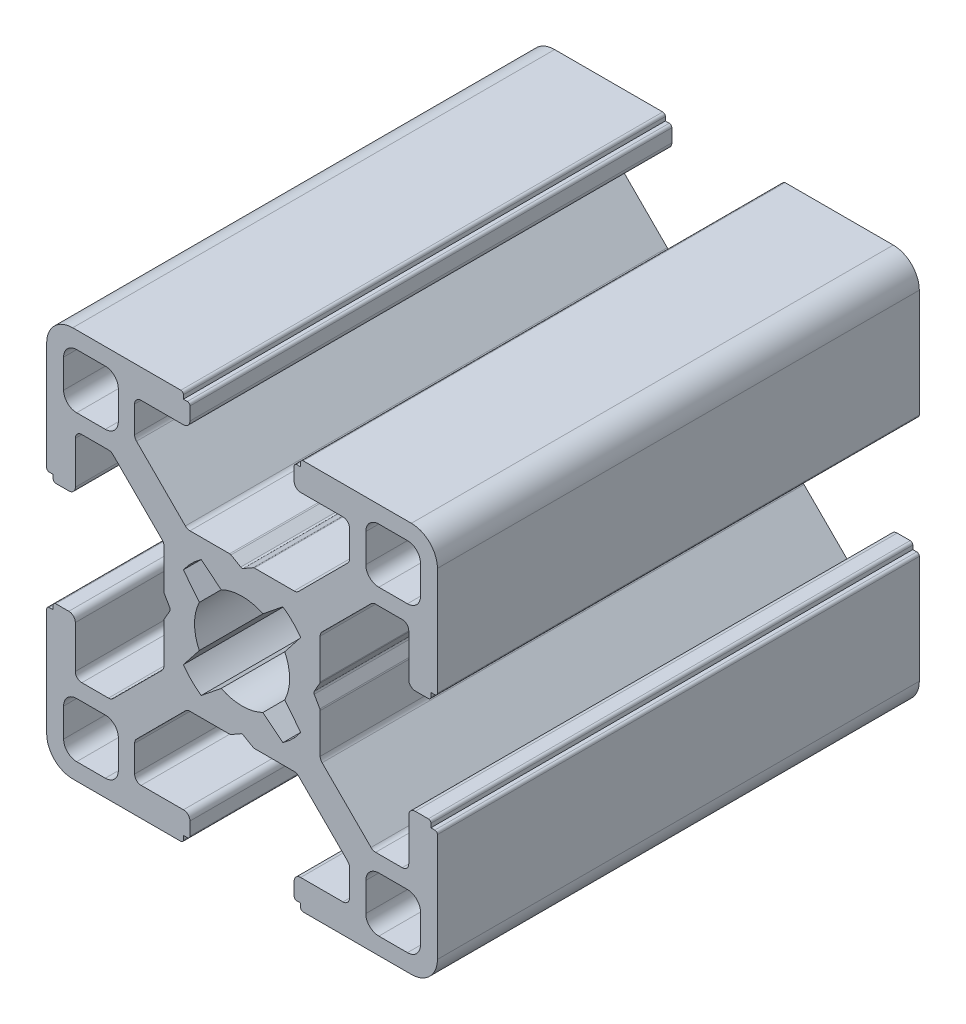
from build123d import *

# Parameters (mm, degrees)
SALIENTE_EXTRUIR1_DEPTH = 1000
CORTAR_EXTRUIR1_START   = -963
CORTAR_EXTRUIR1_DEPTH   = 963


with BuildPart() as part:
    # Croquis1 → Saliente-Extruir1 (new body)
    with BuildSketch(Plane.XY.offset(1000)):
        with BuildLine():
            Line((9.800000436, -10.500000436), (10.100000436, -10.500000436))
            ThreePointArc((10.100000436, -10.500000436), (10.241421792, -10.441421792), (10.300000436, -10.300000436))
            Line((10.300000436, -10.300000436), (10.300000436, -2))
            ThreePointArc((10.300000436, -2), (9.714213998, -0.585786438), (8.300000436, 0))
            Line((8.300000436, 0), (0, 0))
            ThreePointArc((0, 0), (-0.141421356, -0.058578644), (-0.2, -0.2))
            Line((-0.2, -0.2), (-0.2, -0.5))
            Line((-0.2, -0.5), (-0.49999919, -0.5))
            ThreePointArc((-0.49999919, -0.5), (-0.641420811, -0.558578753), (-0.699999564, -0.700000374))
            Line((-0.699999564, -0.700000374), (-0.699999564, -1.700000763))
            ThreePointArc((-0.699999564, -1.700000763), (-0.553552955, -2.053554154), (-0.199999564, -2.200000763))
            Line((-0.199999564, -2.200000763), (3.050000763, -2.200000763))
            ThreePointArc((3.050000763, -2.200000763), (3.403554154, -2.346447372), (3.550000763, -2.700000763))
            Line((3.550000763, -2.700000763), (3.550000763, -4.743055509))
            ThreePointArc((3.550000763, -4.743055509), (3.511993279, -4.934269826), (3.403749103, -5.096413843))
            Line((3.403749103, -5.096413843), (-0.349053376, -8.853358334))
            ThreePointArc((-0.349053376, -8.853358334), (-0.511332616, -8.961886981), (-0.702801716, -9))
            Line((-0.702801716, -9), (-3.746809419, -9))
            ThreePointArc((-3.746809419, -9), (-3.798212795, -9.006718618), (-3.846162576, -9.026423071))
            Line((-3.846162576, -9.026423071), (-4.600646407, -9.458279719))
            ThreePointArc((-4.600646407, -9.458279719), (-4.699999564, -9.48470279), (-4.799352721, -9.458279719))
            Line((-4.799352721, -9.458279719), (-5.553836552, -9.026423071))
            ThreePointArc((-5.553836552, -9.026423071), (-5.601786333, -9.006718618), (-5.653189709, -9))
            Line((-5.653189709, -9), (-8.697197412, -9))
            ThreePointArc((-8.697197412, -9), (-8.888666513, -8.961886981), (-9.050945752, -8.853358334))
            Line((-9.050945752, -8.853358334), (-12.803748231, -5.096413843))
            ThreePointArc((-12.803748231, -5.096413843), (-12.911992407, -4.934269826), (-12.949999891, -4.743055509))
            Line((-12.949999891, -4.743055509), (-12.949999891, -2.700000763))
            ThreePointArc((-12.949999891, -2.700000763), (-12.803553282, -2.346447372), (-12.449999891, -2.200000763))
            Line((-12.449999891, -2.200000763), (-9.199999564, -2.200000763))
            ThreePointArc((-9.199999564, -2.200000763), (-8.846446173, -2.053554154), (-8.699999564, -1.700000763))
            Line((-8.699999564, -1.700000763), (-8.699999564, -0.700000374))
            ThreePointArc((-8.699999564, -0.700000374), (-8.758578317, -0.558578753), (-8.899999938, -0.5))
            Line((-8.899999938, -0.5), (-9.199999128, -0.5))
            Line((-9.199999128, -0.5), (-9.199999128, -0.2))
            ThreePointArc((-9.199999128, -0.2), (-9.258577772, -0.058578644), (-9.399999128, 0))
            Line((-9.399999128, 0), (-17.699999564, 0))
            ThreePointArc((-17.699999564, 0), (-19.114213126, -0.585786438), (-19.699999564, -2))
            Line((-19.699999564, -2), (-19.699999564, -10.300000436))
            ThreePointArc((-19.699999564, -10.300000436), (-19.64142092, -10.441421792), (-19.499999564, -10.500000436))
            Line((-19.499999564, -10.500000436), (-19.199999564, -10.500000436))
            Line((-19.199999564, -10.500000436), (-19.199999564, -10.799999627))
            ThreePointArc((-19.199999564, -10.799999627), (-19.141420811, -10.941421247), (-18.99999919, -11))
            Line((-18.99999919, -11), (-17.999998801, -11))
            ThreePointArc((-17.999998801, -11), (-17.64644541, -10.853553391), (-17.499998801, -10.5))
            Line((-17.499998801, -10.5), (-17.499998801, -7.249999673))
            ThreePointArc((-17.499998801, -7.249999673), (-17.353552192, -6.896446283), (-16.999998801, -6.749999673))
            Line((-16.999998801, -6.749999673), (-14.956944055, -6.749999673))
            ThreePointArc((-14.956944055, -6.749999673), (-14.765729738, -6.788007157), (-14.603585721, -6.896251334))
            Line((-14.603585721, -6.896251334), (-10.84664123, -10.649053813))
            ThreePointArc((-10.84664123, -10.649053813), (-10.738112583, -10.811333052), (-10.699999564, -11.002802152))
            Line((-10.699999564, -11.002802152), (-10.699999564, -14.046809855))
            ThreePointArc((-10.699999564, -14.046809855), (-10.693280947, -14.098213232), (-10.673576493, -14.146163012))
            Line((-10.673576493, -14.146163012), (-10.241719845, -14.900646843))
            ThreePointArc((-10.241719845, -14.900646843), (-10.215296774, -15), (-10.241719845, -15.099353157))
            Line((-10.241719845, -15.099353157), (-10.673576493, -15.853836988))
            ThreePointArc((-10.673576493, -15.853836988), (-10.693280947, -15.901786769), (-10.699999564, -15.953190146))
            Line((-10.699999564, -15.953190146), (-10.699999564, -18.997197848))
            ThreePointArc((-10.699999564, -18.997197848), (-10.738112583, -19.188666949), (-10.84664123, -19.350946188))
            Line((-10.84664123, -19.350946188), (-14.603585721, -23.103748667))
            ThreePointArc((-14.603585721, -23.103748667), (-14.765729738, -23.211992843), (-14.956944055, -23.250000327))
            Line((-14.956944055, -23.250000327), (-16.999998801, -23.250000327))
            ThreePointArc((-16.999998801, -23.250000327), (-17.353552192, -23.103553718), (-17.499998801, -22.750000327))
            Line((-17.499998801, -22.750000327), (-17.499998801, -19.5))
            ThreePointArc((-17.499998801, -19.5), (-17.64644541, -19.14644661), (-17.999998801, -19))
            Line((-17.999998801, -19), (-18.99999919, -19))
            ThreePointArc((-18.99999919, -19), (-19.141420811, -19.058578753), (-19.199999564, -19.200000374))
            Line((-19.199999564, -19.200000374), (-19.199999564, -19.499999564))
            Line((-19.199999564, -19.499999564), (-19.499999564, -19.499999564))
            ThreePointArc((-19.499999564, -19.499999564), (-19.64142092, -19.558578208), (-19.699999564, -19.699999564))
            Line((-19.699999564, -19.699999564), (-19.699999564, -28))
            ThreePointArc((-19.699999564, -28), (-19.114213126, -29.414213563), (-17.699999564, -30))
            Line((-17.699999564, -30), (-9.399999128, -30))
            ThreePointArc((-9.399999128, -30), (-9.258577772, -29.941421356), (-9.199999128, -29.8))
            Line((-9.199999128, -29.8), (-9.199999128, -29.5))
            Line((-9.199999128, -29.5), (-8.899999938, -29.5))
            ThreePointArc((-8.899999938, -29.5), (-8.758578317, -29.441421247), (-8.699999564, -29.299999627))
            Line((-8.699999564, -29.299999627), (-8.699999564, -28.299999237))
            ThreePointArc((-8.699999564, -28.299999237), (-8.846446173, -27.946445847), (-9.199999564, -27.799999237))
            Line((-9.199999564, -27.799999237), (-12.449999891, -27.799999237))
            ThreePointArc((-12.449999891, -27.799999237), (-12.803553282, -27.653552628), (-12.949999891, -27.299999237))
            Line((-12.949999891, -27.299999237), (-12.949999891, -25.256944491))
            ThreePointArc((-12.949999891, -25.256944491), (-12.911992407, -25.065730174), (-12.803748231, -24.903586157))
            Line((-12.803748231, -24.903586157), (-9.050945752, -21.146641666))
            ThreePointArc((-9.050945752, -21.146641666), (-8.888666513, -21.038113019), (-8.697197412, -21))
            Line((-8.697197412, -21), (-5.653189709, -21))
            ThreePointArc((-5.653189709, -21), (-5.601786333, -20.993281383), (-5.553836552, -20.973576929))
            Line((-5.553836552, -20.973576929), (-4.799352721, -20.541720281))
            ThreePointArc((-4.799352721, -20.541720281), (-4.699999564, -20.51529721), (-4.600646407, -20.541720281))
            Line((-4.600646407, -20.541720281), (-3.846162576, -20.973576929))
            ThreePointArc((-3.846162576, -20.973576929), (-3.798212795, -20.993281383), (-3.746809419, -21))
            Line((-3.746809419, -21), (-0.702801716, -21))
            ThreePointArc((-0.702801716, -21), (-0.511332616, -21.038113019), (-0.349053377, -21.146641666))
            Line((-0.349053377, -21.146641666), (3.403749103, -24.903586157))
            ThreePointArc((3.403749103, -24.903586157), (3.511993279, -25.065730174), (3.550000763, -25.256944491))
            Line((3.550000763, -25.256944491), (3.550000763, -27.299999237))
            ThreePointArc((3.550000763, -27.299999237), (3.403554154, -27.653552628), (3.050000763, -27.799999237))
            Line((3.050000763, -27.799999237), (-0.199999564, -27.799999237))
            ThreePointArc((-0.199999564, -27.799999237), (-0.553552955, -27.946445847), (-0.699999564, -28.299999237))
            Line((-0.699999564, -28.299999237), (-0.699999564, -29.299999627))
            ThreePointArc((-0.699999564, -29.299999627), (-0.641420811, -29.441421247), (-0.49999919, -29.5))
            Line((-0.49999919, -29.5), (-0.2, -29.5))
            Line((-0.2, -29.5), (-0.2, -29.8))
            ThreePointArc((-0.2, -29.8), (-0.141421356, -29.941421356), (0, -30))
            Line((0, -30), (8.300000436, -30))
            ThreePointArc((8.300000436, -30), (9.714213998, -29.414213563), (10.300000436, -28))
            Line((10.300000436, -28), (10.300000436, -19.699999564))
            ThreePointArc((10.300000436, -19.699999564), (10.241421792, -19.558578208), (10.100000436, -19.499999564))
            Line((10.100000436, -19.499999564), (9.800000436, -19.499999564))
            Line((9.800000436, -19.499999564), (9.800000436, -19.200000374))
            ThreePointArc((9.800000436, -19.200000374), (9.741421683, -19.058578753), (9.600000062, -19))
            Line((9.600000062, -19), (8.599999673, -19))
            ThreePointArc((8.599999673, -19), (8.246446283, -19.14644661), (8.099999673, -19.5))
            Line((8.099999673, -19.5), (8.099999673, -22.750000327))
            ThreePointArc((8.099999673, -22.750000327), (7.953553064, -23.103553718), (7.599999673, -23.250000327))
            Line((7.599999673, -23.250000327), (5.556944927, -23.250000327))
            ThreePointArc((5.556944927, -23.250000327), (5.36573061, -23.211992843), (5.203586593, -23.103748667))
            Line((5.203586593, -23.103748667), (1.446642102, -19.350946188))
            ThreePointArc((1.446642102, -19.350946188), (1.338113455, -19.188666949), (1.300000436, -18.997197848))
            Line((1.300000436, -18.997197848), (1.300000436, -15.953190145))
            ThreePointArc((1.300000436, -15.953190145), (1.293281819, -15.901786769), (1.273577365, -15.853836988))
            Line((1.273577365, -15.853836988), (0.841720717, -15.099353157))
            ThreePointArc((0.841720717, -15.099353157), (0.815297646, -15), (0.841720717, -14.900646843))
            Line((0.841720717, -14.900646843), (1.273577365, -14.146163012))
            ThreePointArc((1.273577365, -14.146163012), (1.293281819, -14.098213231), (1.300000436, -14.046809855))
            Line((1.300000436, -14.046809855), (1.300000436, -11.002802152))
            ThreePointArc((1.300000436, -11.002802152), (1.338113455, -10.811333051), (1.446642102, -10.649053812))
            Line((1.446642102, -10.649053812), (5.203586593, -6.896251334))
            ThreePointArc((5.203586593, -6.896251334), (5.36573061, -6.788007157), (5.556944927, -6.749999673))
            Line((5.556944927, -6.749999673), (7.599999673, -6.749999673))
            ThreePointArc((7.599999673, -6.749999673), (7.953553064, -6.896446283), (8.099999673, -7.249999673))
            Line((8.099999673, -7.249999673), (8.099999673, -10.5))
            ThreePointArc((8.099999673, -10.5), (8.246446283, -10.853553391), (8.599999673, -11))
            Line((8.599999673, -11), (9.600000062, -11))
            ThreePointArc((9.600000062, -11), (9.741421683, -10.941421247), (9.800000436, -10.799999627))
            Line((9.800000436, -10.799999627), (9.800000436, -10.500000436))
        make_face()
        with BuildLine():
            Line((8.000001536, -5.500000365), (5.800000754, -5.500000365))
            ThreePointArc((5.800000754, -5.500000365), (5.092893979, -5.207107149), (4.800000763, -4.500000374))
            Line((4.800000763, -4.500000374), (4.800000763, -2.299999592))
            ThreePointArc((4.800000763, -2.299999592), (5.092893979, -1.592892818), (5.800000754, -1.299999602))
            Line((5.800000754, -1.299999602), (8.000001536, -1.299999602))
            ThreePointArc((8.000001536, -1.299999602), (8.70710831, -1.592892818), (9.000001526, -2.299999592))
            Line((9.000001526, -2.299999592), (9.000001526, -4.500000374))
            ThreePointArc((9.000001526, -4.500000374), (8.70710831, -5.207107149), (8.000001536, -5.500000365))
        make_face(mode=Mode.SUBTRACT)
        with BuildLine():
            Line((-15.199999881, -5.500000365), (-17.400000663, -5.500000365))
            ThreePointArc((-17.400000663, -5.500000365), (-18.107107438, -5.207107149), (-18.400000654, -4.500000374))
            Line((-18.400000654, -4.500000374), (-18.400000654, -2.299999592))
            ThreePointArc((-18.400000654, -2.299999592), (-18.107107438, -1.592892818), (-17.400000664, -1.299999602))
            Line((-17.400000664, -1.299999602), (-15.199999881, -1.299999602))
            ThreePointArc((-15.199999881, -1.299999602), (-14.492893107, -1.592892818), (-14.199999891, -2.299999592))
            Line((-14.199999891, -2.299999592), (-14.199999891, -4.500000374))
            ThreePointArc((-14.199999891, -4.500000374), (-14.492893107, -5.207107149), (-15.199999881, -5.500000365))
        make_face(mode=Mode.SUBTRACT)
        with BuildLine():
            Line((-17.400000664, -24.499999636), (-15.199999881, -24.499999636))
            ThreePointArc((-15.199999881, -24.499999636), (-14.492893107, -24.792892852), (-14.199999891, -25.499999626))
            Line((-14.199999891, -25.499999626), (-14.199999891, -27.700000408))
            ThreePointArc((-14.199999891, -27.700000408), (-14.492893107, -28.407107183), (-15.199999881, -28.700000399))
            Line((-15.199999881, -28.700000399), (-17.400000663, -28.700000399))
            ThreePointArc((-17.400000663, -28.700000399), (-18.107107438, -28.407107183), (-18.400000654, -27.700000408))
            Line((-18.400000654, -27.700000408), (-18.400000654, -25.499999626))
            ThreePointArc((-18.400000654, -25.499999626), (-18.107107438, -24.792892852), (-17.400000664, -24.499999636))
        make_face(mode=Mode.SUBTRACT)
        with BuildLine():
            Line((5.800000754, -24.499999636), (8.000001536, -24.499999636))
            ThreePointArc((8.000001536, -24.499999636), (8.70710831, -24.792892852), (9.000001526, -25.499999626))
            Line((9.000001526, -25.499999626), (9.000001526, -27.700000408))
            ThreePointArc((9.000001526, -27.700000408), (8.70710831, -28.407107183), (8.000001536, -28.700000399))
            Line((8.000001536, -28.700000399), (5.800000754, -28.700000399))
            ThreePointArc((5.800000754, -28.700000399), (5.092893979, -28.407107183), (4.800000763, -27.700000408))
            Line((4.800000763, -27.700000408), (4.800000763, -25.499999626))
            ThreePointArc((4.800000763, -25.499999626), (5.092893979, -24.792892852), (5.800000754, -24.499999636))
        make_face(mode=Mode.SUBTRACT)
        with BuildLine():
            Line((-7.835928976, -10.481599097), (-6.300129088, -11.719438233))
            ThreePointArc((-6.300129088, -11.719438233), (-4.699999564, -11.35), (-3.09987004, -11.719438233))
            Line((-3.09987004, -11.719438233), (-1.564070152, -10.481599097))
            ThreePointArc((-1.564070152, -10.481599097), (-0.818997305, -11.10284444), (-0.194662672, -11.845330527))
            Line((-0.194662672, -11.845330527), (-1.419437832, -13.399870404))
            ThreePointArc((-1.419437832, -13.399870404), (-1.049999564, -15), (-1.419437832, -16.600129597))
            Line((-1.419437832, -16.600129597), (-0.194662672, -18.154669473))
            ThreePointArc((-0.194662672, -18.154669473), (-0.818997305, -18.897155561), (-1.564070152, -19.518400903))
            Line((-1.564070152, -19.518400903), (-3.09987004, -18.280561767))
            ThreePointArc((-3.09987004, -18.280561767), (-4.699999564, -18.65), (-6.300129088, -18.280561767))
            Line((-6.300129088, -18.280561767), (-7.835928976, -19.518400903))
            ThreePointArc((-7.835928976, -19.518400903), (-8.581001823, -18.897155561), (-9.205336456, -18.154669473))
            Line((-9.205336456, -18.154669473), (-7.980561295, -16.600129597))
            ThreePointArc((-7.980561295, -16.600129597), (-8.349999564, -15), (-7.980561296, -13.399870404))
            Line((-7.980561296, -13.399870404), (-9.205336456, -11.845330527))
            ThreePointArc((-9.205336456, -11.845330527), (-8.581001823, -11.10284444), (-7.835928976, -10.481599097))
        make_face(mode=Mode.SUBTRACT)
    extrude(amount=-SALIENTE_EXTRUIR1_DEPTH)

    # Croquis4 → Cortar-Extruir1 (cut)
    with BuildSketch(Plane(origin=(0, 0, 0), x_dir=(-1, 0, 0), z_dir=(0, 0, -1)).offset(CORTAR_EXTRUIR1_START)):
        with BuildLine():
            Line((-9.800000436, -10.500000436), (-9.800000436, -10.799999627))
            ThreePointArc((-9.800000436, -10.799999627), (-9.741421683, -10.941421247), (-9.600000062, -11))
            Line((-9.600000062, -11), (-8.599999673, -11))
            ThreePointArc((-8.599999673, -11), (-8.246446283, -10.853553391), (-8.099999673, -10.5))
            Line((-8.099999673, -10.5), (-8.099999673, -7.249999673))
            ThreePointArc((-8.099999673, -7.249999673), (-7.953553064, -6.896446283), (-7.599999673, -6.749999673))
            Line((-7.599999673, -6.749999673), (-5.556944927, -6.749999673))
            ThreePointArc((-5.556944927, -6.749999673), (-5.36573061, -6.788007157), (-5.203586593, -6.896251334))
            Line((-5.203586593, -6.896251334), (-1.446642102, -10.649053812))
            ThreePointArc((-1.446642102, -10.649053812), (-1.338113455, -10.811333051), (-1.300000436, -11.002802152))
            Line((-1.300000436, -11.002802152), (-1.300000436, -14.046809855))
            ThreePointArc((-1.300000436, -14.046809855), (-1.293281819, -14.098213231), (-1.273577365, -14.146163012))
            Line((-1.273577365, -14.146163012), (-0.841720717, -14.900646843))
            ThreePointArc((-0.841720717, -14.900646843), (-0.815297646, -15), (-0.841720717, -15.099353157))
            Line((-0.841720717, -15.099353157), (-1.273577365, -15.853836988))
            ThreePointArc((-1.273577365, -15.853836988), (-1.293281819, -15.901786769), (-1.300000436, -15.953190145))
            Line((-1.300000436, -15.953190145), (-1.300000436, -18.997197848))
            ThreePointArc((-1.300000436, -18.997197848), (-1.338113455, -19.188666949), (-1.446642102, -19.350946188))
            Line((-1.446642102, -19.350946188), (-5.203586593, -23.103748667))
            ThreePointArc((-5.203586593, -23.103748667), (-5.36573061, -23.211992843), (-5.556944927, -23.250000327))
            Line((-5.556944927, -23.250000327), (-7.599999673, -23.250000327))
            ThreePointArc((-7.599999673, -23.250000327), (-7.953553064, -23.103553718), (-8.099999673, -22.750000327))
            Line((-8.099999673, -22.750000327), (-8.099999673, -19.5))
            ThreePointArc((-8.099999673, -19.5), (-8.246446283, -19.14644661), (-8.599999673, -19))
            Line((-8.599999673, -19), (-9.600000062, -19))
            ThreePointArc((-9.600000062, -19), (-9.741421683, -19.058578753), (-9.800000436, -19.200000374))
            Line((-9.800000436, -19.200000374), (-9.800000436, -19.499999564))
            Line((-9.800000436, -19.499999564), (-10.100000436, -19.499999564))
            ThreePointArc((-10.100000436, -19.499999564), (-10.241421792, -19.558578208), (-10.300000436, -19.699999564))
            Line((-10.300000436, -19.699999564), (-10.300000436, -28))
            ThreePointArc((-10.300000436, -28), (-9.714213998, -29.414213563), (-8.300000436, -30))
            Line((-8.300000436, -30), (0, -30))
            ThreePointArc((0, -30), (0.141421356, -29.941421356), (0.2, -29.8))
            Line((0.2, -29.8), (0.2, -29.5))
            Line((0.2, -29.5), (0.49999919, -29.5))
            ThreePointArc((0.49999919, -29.5), (0.641420811, -29.441421247), (0.699999564, -29.299999627))
            Line((0.699999564, -29.299999627), (0.699999564, -28.299999237))
            ThreePointArc((0.699999564, -28.299999237), (0.553552955, -27.946445847), (0.199999564, -27.799999237))
            Line((0.199999564, -27.799999237), (-3.050000763, -27.799999237))
            ThreePointArc((-3.050000763, -27.799999237), (-3.403554154, -27.653552628), (-3.550000763, -27.299999237))
            Line((-3.550000763, -27.299999237), (-3.550000763, -25.256944491))
            ThreePointArc((-3.550000763, -25.256944491), (-3.511993279, -25.065730174), (-3.403749103, -24.903586157))
            Line((-3.403749103, -24.903586157), (0.349053377, -21.146641666))
            ThreePointArc((0.349053377, -21.146641666), (0.511332616, -21.038113019), (0.702801716, -21))
            Line((0.702801716, -21), (3.746809419, -21))
            ThreePointArc((3.746809419, -21), (3.798212795, -20.993281383), (3.846162576, -20.973576929))
            Line((3.846162576, -20.973576929), (4.600646407, -20.541720281))
            ThreePointArc((4.600646407, -20.541720281), (4.699999564, -20.51529721), (4.799352721, -20.541720281))
            Line((4.799352721, -20.541720281), (5.553836552, -20.973576929))
            ThreePointArc((5.553836552, -20.973576929), (5.601786333, -20.993281383), (5.653189709, -21))
            Line((5.653189709, -21), (8.697197412, -21))
            ThreePointArc((8.697197412, -21), (8.888666513, -21.038113019), (9.050945752, -21.146641666))
            Line((9.050945752, -21.146641666), (12.803748231, -24.903586157))
            ThreePointArc((12.803748231, -24.903586157), (12.911992407, -25.065730174), (12.949999891, -25.256944491))
            Line((12.949999891, -25.256944491), (12.949999891, -27.299999237))
            ThreePointArc((12.949999891, -27.299999237), (12.803553282, -27.653552628), (12.449999891, -27.799999237))
            Line((12.449999891, -27.799999237), (9.199999564, -27.799999237))
            ThreePointArc((9.199999564, -27.799999237), (8.846446173, -27.946445847), (8.699999564, -28.299999237))
            Line((8.699999564, -28.299999237), (8.699999564, -29.299999627))
            ThreePointArc((8.699999564, -29.299999627), (8.758578317, -29.441421247), (8.899999938, -29.5))
            Line((8.899999938, -29.5), (9.199999128, -29.5))
            Line((9.199999128, -29.5), (9.199999128, -29.8))
            ThreePointArc((9.199999128, -29.8), (9.258577772, -29.941421356), (9.399999128, -30))
            Line((9.399999128, -30), (17.699999564, -30))
            ThreePointArc((17.699999564, -30), (19.114213126, -29.414213563), (19.699999564, -28))
            Line((19.699999564, -28), (19.699999564, -19.699999564))
            ThreePointArc((19.699999564, -19.699999564), (19.64142092, -19.558578208), (19.499999564, -19.499999564))
            Line((19.499999564, -19.499999564), (19.199999564, -19.499999564))
            Line((19.199999564, -19.499999564), (19.199999564, -19.200000374))
            ThreePointArc((19.199999564, -19.200000374), (19.141420811, -19.058578753), (18.99999919, -19))
            Line((18.99999919, -19), (17.999998801, -19))
            ThreePointArc((17.999998801, -19), (17.64644541, -19.14644661), (17.499998801, -19.5))
            Line((17.499998801, -19.5), (17.499998801, -22.750000327))
            ThreePointArc((17.499998801, -22.750000327), (17.353552192, -23.103553718), (16.999998801, -23.250000327))
            Line((16.999998801, -23.250000327), (14.956944055, -23.250000327))
            ThreePointArc((14.956944055, -23.250000327), (14.765729738, -23.211992843), (14.603585721, -23.103748667))
            Line((14.603585721, -23.103748667), (10.84664123, -19.350946188))
            ThreePointArc((10.84664123, -19.350946188), (10.738112583, -19.188666949), (10.699999564, -18.997197848))
            Line((10.699999564, -18.997197848), (10.699999564, -15.953190146))
            ThreePointArc((10.699999564, -15.953190146), (10.693280947, -15.901786769), (10.673576493, -15.853836988))
            Line((10.673576493, -15.853836988), (10.241719845, -15.099353157))
            ThreePointArc((10.241719845, -15.099353157), (10.215296774, -15), (10.241719845, -14.900646843))
            Line((10.241719845, -14.900646843), (10.673576493, -14.146163012))
            ThreePointArc((10.673576493, -14.146163012), (10.693280947, -14.098213232), (10.699999564, -14.046809855))
            Line((10.699999564, -14.046809855), (10.699999564, -11.002802152))
            ThreePointArc((10.699999564, -11.002802152), (10.738112583, -10.811333052), (10.84664123, -10.649053813))
            Line((10.84664123, -10.649053813), (14.603585721, -6.896251334))
            ThreePointArc((14.603585721, -6.896251334), (14.765729738, -6.788007157), (14.956944055, -6.749999673))
            Line((14.956944055, -6.749999673), (16.999998801, -6.749999673))
            ThreePointArc((16.999998801, -6.749999673), (17.353552192, -6.896446283), (17.499998801, -7.249999673))
            Line((17.499998801, -7.249999673), (17.499998801, -10.5))
            ThreePointArc((17.499998801, -10.5), (17.64644541, -10.853553391), (17.999998801, -11))
            Line((17.999998801, -11), (18.99999919, -11))
            ThreePointArc((18.99999919, -11), (19.141420811, -10.941421247), (19.199999564, -10.799999627))
            Line((19.199999564, -10.799999627), (19.199999564, -10.500000436))
            Line((19.199999564, -10.500000436), (19.499999564, -10.500000436))
            ThreePointArc((19.499999564, -10.500000436), (19.64142092, -10.441421792), (19.699999564, -10.300000436))
            Line((19.699999564, -10.300000436), (19.699999564, -2))
            ThreePointArc((19.699999564, -2), (19.114213126, -0.585786438), (17.699999564, 0))
            Line((17.699999564, 0), (9.399999128, 0))
            ThreePointArc((9.399999128, 0), (9.258577772, -0.058578644), (9.199999128, -0.2))
            Line((9.199999128, -0.2), (9.199999128, -0.5))
            Line((9.199999128, -0.5), (8.899999938, -0.5))
            ThreePointArc((8.899999938, -0.5), (8.758578317, -0.558578753), (8.699999564, -0.700000374))
            Line((8.699999564, -0.700000374), (8.699999564, -1.700000763))
            ThreePointArc((8.699999564, -1.700000763), (8.846446173, -2.053554154), (9.199999564, -2.200000763))
            Line((9.199999564, -2.200000763), (12.449999891, -2.200000763))
            ThreePointArc((12.449999891, -2.200000763), (12.803553282, -2.346447372), (12.949999891, -2.700000763))
            Line((12.949999891, -2.700000763), (12.949999891, -4.743055509))
            ThreePointArc((12.949999891, -4.743055509), (12.911992407, -4.934269826), (12.803748231, -5.096413843))
            Line((12.803748231, -5.096413843), (9.050945752, -8.853358334))
            ThreePointArc((9.050945752, -8.853358334), (8.888666513, -8.961886981), (8.697197412, -9))
            Line((8.697197412, -9), (5.653189709, -9))
            ThreePointArc((5.653189709, -9), (5.601786333, -9.006718618), (5.553836552, -9.026423071))
            Line((5.553836552, -9.026423071), (4.799352721, -9.458279719))
            ThreePointArc((4.799352721, -9.458279719), (4.699999564, -9.48470279), (4.600646407, -9.458279719))
            Line((4.600646407, -9.458279719), (3.846162576, -9.026423071))
            ThreePointArc((3.846162576, -9.026423071), (3.798212795, -9.006718618), (3.746809419, -9))
            Line((3.746809419, -9), (0.702801716, -9))
            ThreePointArc((0.702801716, -9), (0.511332616, -8.961886981), (0.349053376, -8.853358334))
            Line((0.349053376, -8.853358334), (-3.403749103, -5.096413843))
            ThreePointArc((-3.403749103, -5.096413843), (-3.511993279, -4.934269826), (-3.550000763, -4.743055509))
            Line((-3.550000763, -4.743055509), (-3.550000763, -2.700000763))
            ThreePointArc((-3.550000763, -2.700000763), (-3.403554154, -2.346447372), (-3.050000763, -2.200000763))
            Line((-3.050000763, -2.200000763), (0.199999564, -2.200000763))
            ThreePointArc((0.199999564, -2.200000763), (0.553552955, -2.053554154), (0.699999564, -1.700000763))
            Line((0.699999564, -1.700000763), (0.699999564, -0.700000374))
            ThreePointArc((0.699999564, -0.700000374), (0.641420811, -0.558578753), (0.49999919, -0.5))
            Line((0.49999919, -0.5), (0.2, -0.5))
            Line((0.2, -0.5), (0.2, -0.2))
            ThreePointArc((0.2, -0.2), (0.141421356, -0.058578644), (0, 0))
            Line((0, 0), (-8.300000436, 0))
            ThreePointArc((-8.300000436, 0), (-9.714213998, -0.585786438), (-10.300000436, -2))
            Line((-10.300000436, -2), (-10.300000436, -10.300000436))
            ThreePointArc((-10.300000436, -10.300000436), (-10.241421792, -10.441421792), (-10.100000436, -10.500000436))
            Line((-10.100000436, -10.500000436), (-9.800000436, -10.500000436))
        make_face()
    extrude(amount=CORTAR_EXTRUIR1_DEPTH, mode=Mode.SUBTRACT)


solid = part.part
